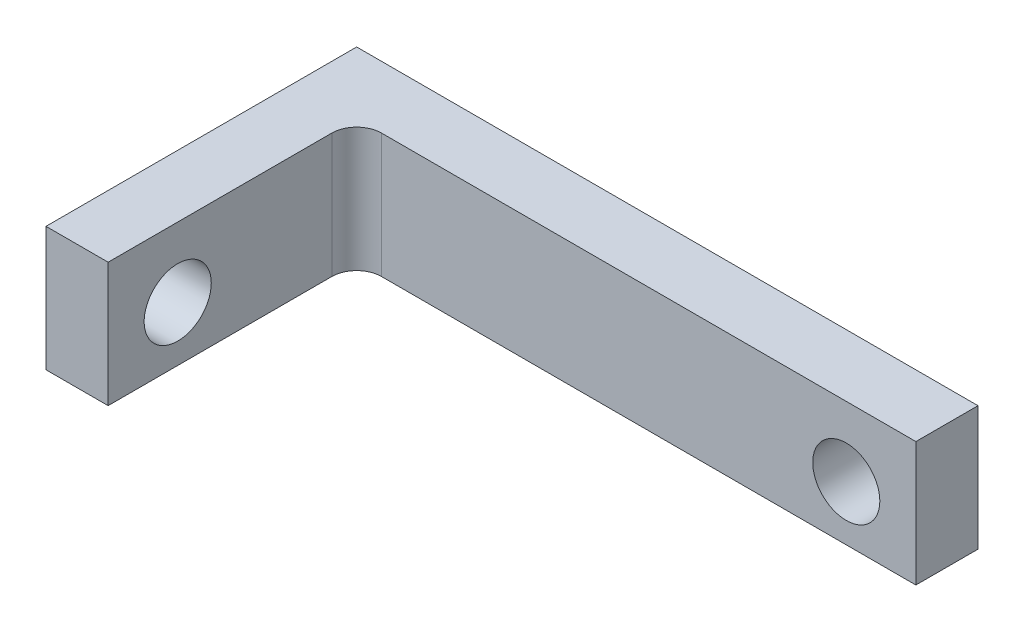
from build123d import *

# Parameters (mm, degrees)
BOSS_EXTRUDE1_DEPTH = 10
SKETCH2_R           = 2.7
CUT_EXTRUDE1_DEPTH  = 53.440442409
SKETCH3_R           = 2.7
CUT_EXTRUDE2_DEPTH  = 34.541019662
FILLET1_R           = 2


with BuildPart() as part:
    # Sketch1 → Boss-Extrude1 (new body)
    with BuildSketch(Plane(origin=(0, 0, 0), x_dir=(1, 0, 0), z_dir=(0, 1, 0))):
        Polygon((-25, 0), (25, 0), (25, -5), (-20, -5), (-20, -25), (-25, -25), align=None)
    extrude(amount=BOSS_EXTRUDE1_DEPTH)

    # Sketch2 → Cut-Extrude1 (cut, through all)
    with BuildSketch(Plane(origin=(-20, 0, 0), x_dir=(0, 0, -1), z_dir=(1, 0, 0))):
        with Locations((-19.4, 4.4)):
            Circle(SKETCH2_R)
    extrude(amount=-CUT_EXTRUDE1_DEPTH, mode=Mode.SUBTRACT)

    # Sketch3 → Cut-Extrude2 (cut, through all)
    with BuildSketch(Plane.XY.offset(5)):
        with Locations((19.4, 4.4)):
            Circle(SKETCH3_R)
    extrude(amount=-CUT_EXTRUDE2_DEPTH, mode=Mode.SUBTRACT)

    # Fillet1
    fillet1_edges = [part.edges().sort_by_distance(p)[0] for p in [
        (-20, 5, 5),
    ]]
    fillet(fillet1_edges, radius=FILLET1_R)


solid = part.part
